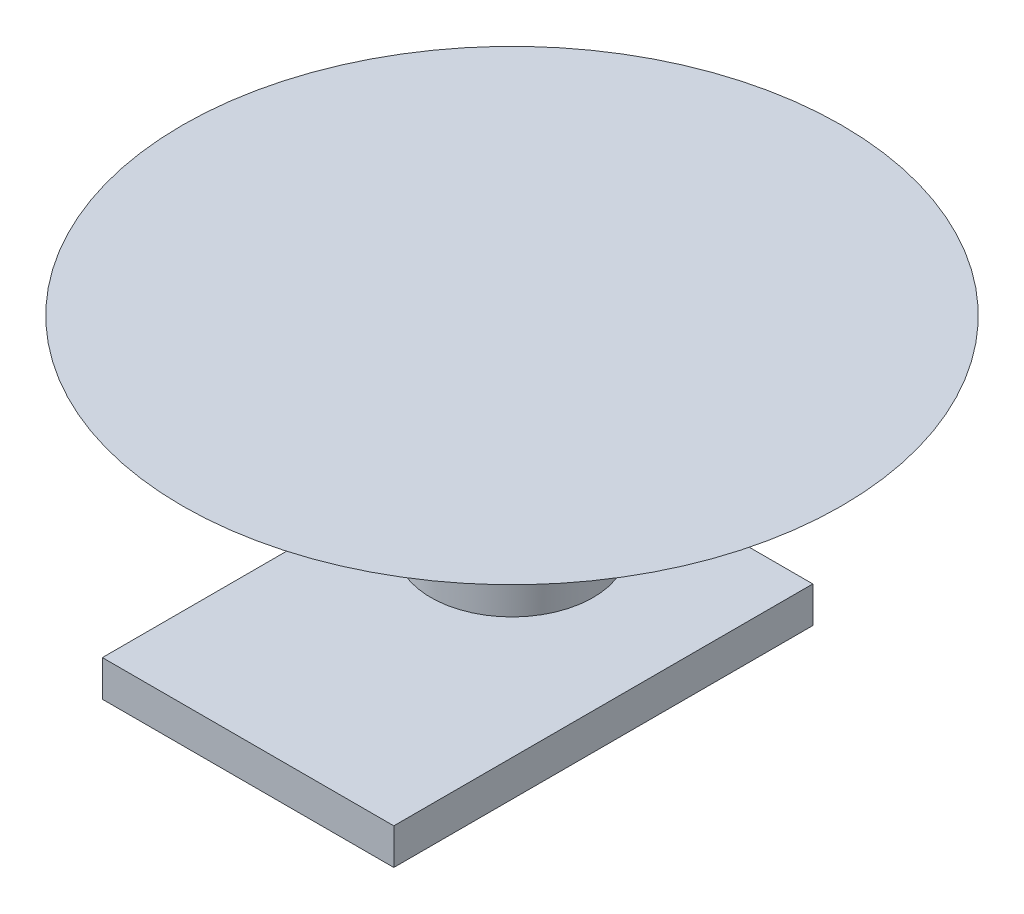
from build123d import *

# Parameters (mm, degrees)
SKETCH1_W           = 41.021
SKETCH1_H           = 58.9788
BOSS_EXTRUDE1_DEPTH = 5.08
SKETCH2_R           = 11.43
BOSS_EXTRUDE2_DEPTH = 8.001


with BuildPart() as part:
    # Sketch1 → Boss-Extrude1 (new body)
    with BuildSketch(Plane(origin=(0, 0, 0), x_dir=(1, 0, 0), z_dir=(0, 1, 0))):
        Rectangle(SKETCH1_W, SKETCH1_H)
    extrude(amount=BOSS_EXTRUDE1_DEPTH)

    # Sketch2 → Boss-Extrude2 (add)
    with BuildSketch(Plane(origin=(0, 5.08, 0), x_dir=(1, 0, 0), z_dir=(0, 1, 0))):
        with Locations(Location((-4.7117, 12.3698, 0), (0, 0, 90))):
            Circle(SKETCH2_R)
    extrude(amount=BOSS_EXTRUDE2_DEPTH)


with BuildPart() as body_2:
    # Sketch6 → Revolve1 (revolve)
    with BuildSketch(Plane(origin=(-4.7117, 0, 0), x_dir=(0, 0, -1), z_dir=(1, 0, 0)), mode=Mode.PRIVATE) as revolve1_sk:
        Polygon((12.3698, 13.081), (58.777909248, 33.743221468), (12.3698, 33.743221468), align=None)
    revolve(revolve1_sk.sketch.rotate(Axis((-4.7117, 33.743221468, -12.3698), (0, -1, 0)), 180), axis=Axis((-4.7117, 33.743221468, -12.3698), (0, -1, 0)))


solid = Compound([part.part, body_2.part])
